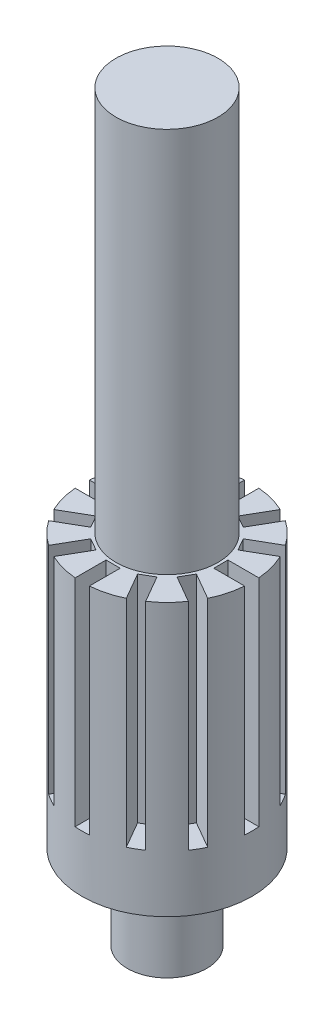
from build123d import *

# Parameters (mm, degrees)
SKETCH1_R           = 15
SKETCH1_R_2         = 9
BOSS_EXTRUDE1_DEPTH = 48
SKETCH1_4_R         = 9
BOSS_EXTRUDE2_DEPTH = 68
SKETCH2_R           = 7
BOSS_EXTRUDE3_DEPTH = 15
SKETCH3_W           = 2.5
SKETCH3_H           = 6.210165372
CUT_EXTRUDE1_DEPTH  = 38
CIRPATTERN1_COUNT   = 12
SKETCH4_R           = 1.25
CUT_EXTRUDE2_DEPTH  = 15


with BuildPart() as part:
    # Sketch1 → Boss-Extrude1 (new body)
    # profile 1 of 2: a face of its own
    with BuildSketch(Plane(origin=(0, 0, 0), x_dir=(1, 0, 0), z_dir=(0, 1, 0))):
        with Locations(Location((0, 0, 0), (0, 0, 270))):
            Circle(SKETCH1_R)
        Circle(SKETCH1_R_2, mode=Mode.SUBTRACT)
    # profile 2 of 2: a face of its own
    with BuildSketch(Plane(origin=(0, 0, 0), x_dir=(1, 0, 0), z_dir=(0, 1, 0))):
        Circle(SKETCH1_R_2)
    extrude(amount=-BOSS_EXTRUDE1_DEPTH)

    # Sketch1<4> → Boss-Extrude2 (add)
    with BuildSketch(Plane(origin=(0, 0, 0), x_dir=(1, 0, 0), z_dir=(0, 1, 0))):
        with Locations(Location((0, 0, 0), (0, 0, 270))):
            Circle(SKETCH1_4_R)
    extrude(amount=BOSS_EXTRUDE2_DEPTH)

    # Sketch2 → Boss-Extrude3 (add)
    with BuildSketch(Plane.XZ.offset(48)):
        with Locations(Location((0, 0, 0), (0, 0, 270))):
            Circle(SKETCH2_R)
    extrude(amount=BOSS_EXTRUDE3_DEPTH)

    # Sketch3 → Cut-Extrude1 (cut)
    with BuildSketch(Plane(origin=(0, 0, 0), x_dir=(1, 0, 0), z_dir=(0, 1, 0))):
        with Locations((0, 12.605082686)):
            Rectangle(SKETCH3_W, SKETCH3_H)
    cut_extrude1 = extrude(amount=-CUT_EXTRUDE1_DEPTH, mode=Mode.SUBTRACT)

    # CirPattern1: Cut-Extrude1 ×12 about axis
    cirpattern1_axis = Axis((0, 0, 0), (0, 1, 0))
    for i in range(1, CIRPATTERN1_COUNT):
        add(cut_extrude1.rotate(cirpattern1_axis, i * 360 / CIRPATTERN1_COUNT), mode=Mode.SUBTRACT)

    # Sketch4 → Cut-Extrude2 (cut)
    with BuildSketch(Plane.XZ.offset(63)):
        with Locations(Location((0, 0, 0), (0, 0, 270))):
            Circle(SKETCH4_R)
    extrude(amount=-CUT_EXTRUDE2_DEPTH, mode=Mode.SUBTRACT)


solid = part.part
